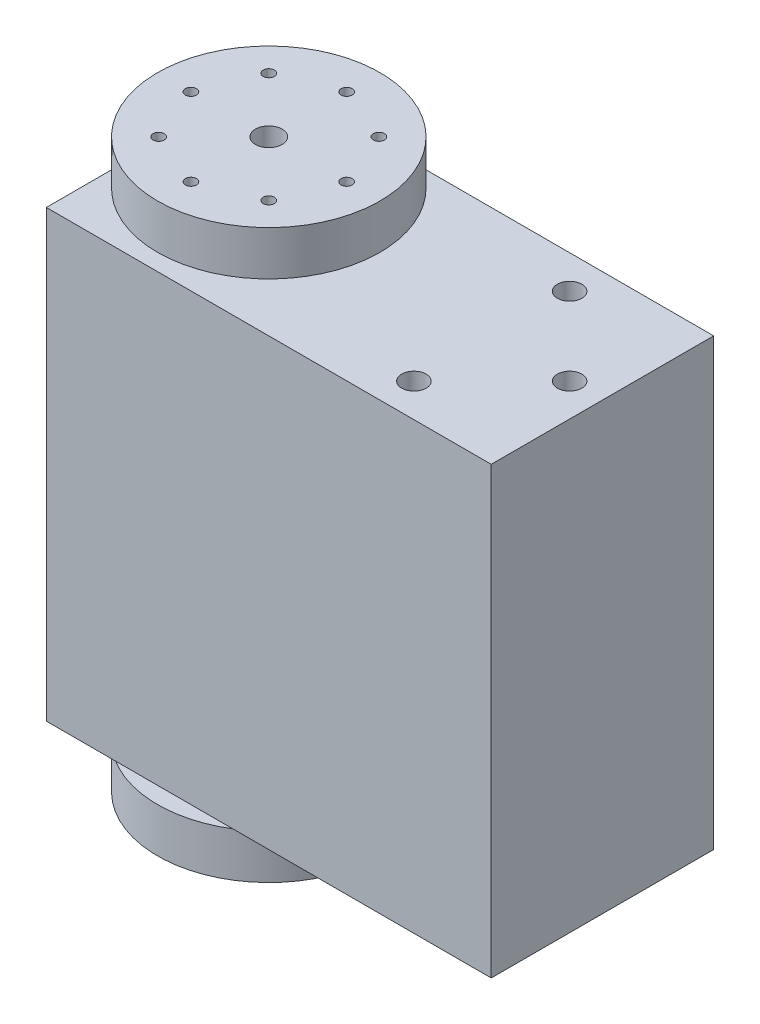
from build123d import *

# Parameters (mm, degrees)
SKETCH1_W           = 40
SKETCH1_H           = 20
BOSS_EXTRUDE1_DEPTH = 40
SKETCH3_R           = 6.5
BOSS_EXTRUDE2_DEPTH = 1.5
BOSS_EXTRUDE3_START = 1.5
SKETCH4_R           = 6.5
BOSS_EXTRUDE3_DEPTH = 1.5
SKETCH5_R           = 10
SKETCH5_R_2         = 1.15
BOSS_EXTRUDE4_DEPTH = 4
BOSS_EXTRUDE6_START = 4
SKETCH6_R           = 10
SKETCH6_R_2         = 1.2
BOSS_EXTRUDE6_DEPTH = 4
SKETCH8_W           = 8
SKETCH8_H           = 5
CUT_EXTRUDE1_DEPTH  = 3
SKETCH9_R           = 1.1
CUT_EXTRUDE2_DEPTH  = 3
SKETCH10_R          = 1.1
CUT_EXTRUDE3_DEPTH  = 3
SKETCH13_R          = 0.5
CUT_EXTRUDE5_DEPTH  = 4
CUT_EXTRUDE6_START  = -4
SKETCH14_R          = 0.5
CUT_EXTRUDE6_DEPTH  = 4


with BuildPart() as part:
    # Sketch1 → Boss-Extrude1 (new body)
    with BuildSketch(Plane(origin=(0, 0, 0), x_dir=(1, 0, 0), z_dir=(0, 1, 0))):
        with Locations((-233.769788889, 149.901843582)):
            Rectangle(SKETCH1_W, SKETCH1_H)
    extrude(amount=BOSS_EXTRUDE1_DEPTH)

    # Sketch3 → Boss-Extrude2 (add)
    with BuildSketch(Plane(origin=(0, 40, 0), x_dir=(1, 0, 0), z_dir=(0, 1, 0))):
        with Locations(Location((-243.769788889, 149.901843582, 0), (0, 0, 270))):
            Circle(SKETCH3_R)
    extrude(amount=BOSS_EXTRUDE2_DEPTH)

    # Sketch4 → Boss-Extrude3 (add)
    with BuildSketch(Plane.XZ.offset(BOSS_EXTRUDE3_START)):
        with Locations(Location((-243.769788889, -149.901843582, 0), (0, 0, 90))):
            Circle(SKETCH4_R)
    extrude(amount=-BOSS_EXTRUDE3_DEPTH)

    # Sketch5 → Boss-Extrude4 (add)
    with BuildSketch(Plane.XZ.offset(1.5)):
        with Locations(Location((-243.769788889, -149.901843582, 0), (0, 0, 270))):
            Circle(SKETCH5_R)
        with Locations(Location((-243.769788889, -149.901843582, 0), (0, 0, 270))):
            Circle(SKETCH5_R_2, mode=Mode.SUBTRACT)
    extrude(amount=BOSS_EXTRUDE4_DEPTH)

    # Sketch6 → Boss-Extrude6 (add)
    with BuildSketch(Plane(origin=(0, 41.5, 0), x_dir=(1, 0, 0), z_dir=(0, 1, 0)).offset(BOSS_EXTRUDE6_START)):
        with Locations(Location((-243.769788889, 149.901843582, 0), (0, 0, 90))):
            Circle(SKETCH6_R)
        with Locations(Location((-243.769788889, 149.901843582, 0), (0, 0, 270))):
            Circle(SKETCH6_R_2, mode=Mode.SUBTRACT)
    extrude(amount=-BOSS_EXTRUDE6_DEPTH)

    # Sketch8 → Cut-Extrude1 (cut)
    with BuildSketch(Plane.ZY.offset(253.769788889)):
        with Locations((-149.901843582, 10.471280392)):
            Rectangle(SKETCH8_W, SKETCH8_H)
    extrude(amount=-CUT_EXTRUDE1_DEPTH, mode=Mode.SUBTRACT)

    # Sketch9 → Cut-Extrude2 (cut)
    with BuildSketch(Plane(origin=(0, 40, 0), x_dir=(1, 0, 0), z_dir=(0, 1, 0))):
        with Locations(Location((-216.719788889, 149.901843582, 0), (0, 0, 270))):
            Circle(SKETCH9_R)
        with Locations(Location((-223.719788889, 142.901843582, 0), (0, 0, 270))):
            Circle(SKETCH9_R)
        with Locations(Location((-223.719788889, 156.901843582, 0), (0, 0, 270))):
            Circle(SKETCH9_R)
    extrude(amount=-CUT_EXTRUDE2_DEPTH, mode=Mode.SUBTRACT)

    # Sketch10 → Cut-Extrude3 (cut)
    with BuildSketch(Plane.XZ):
        with Locations(Location((-216.239788889, -157.401843582, 0), (0, 0, 270))):
            Circle(SKETCH10_R)
        with Locations(Location((-216.239788889, -142.401843582, 0), (0, 0, 270))):
            Circle(SKETCH10_R)
        with Locations(Location((-231.239788889, -157.401843582, 0), (0, 0, 270))):
            Circle(SKETCH10_R)
        with Locations(Location((-231.239788889, -142.401843582, 0), (0, 0, 270))):
            Circle(SKETCH10_R)
    extrude(amount=-CUT_EXTRUDE3_DEPTH, mode=Mode.SUBTRACT)

    # Sketch13 → Cut-Extrude5 (cut)
    with BuildSketch(Plane.XZ.offset(5.5)):
        with Locations(Location((-243.769788889, -142.901843582, 0), (0, 0, 270))):
            Circle(SKETCH13_R)
        with Locations(Location((-238.82004142, -144.952096113, 0), (0, 0, 270))):
            Circle(SKETCH13_R)
        with Locations(Location((-236.769788889, -149.901843582, 0), (0, 0, 270))):
            Circle(SKETCH13_R)
        with Locations(Location((-238.82004142, -154.85159105, 0), (0, 0, 270))):
            Circle(SKETCH13_R)
        with Locations(Location((-243.769788889, -156.901843582, 0), (0, 0, 270))):
            Circle(SKETCH13_R)
        with Locations(Location((-248.719536357, -154.85159105, 0), (0, 0, 270))):
            Circle(SKETCH13_R)
        with Locations(Location((-250.769788889, -149.901843582, 0), (0, 0, 270))):
            Circle(SKETCH13_R)
        with Locations(Location((-248.719536357, -144.952096113, 0), (0, 0, 270))):
            Circle(SKETCH13_R)
    extrude(amount=-CUT_EXTRUDE5_DEPTH, mode=Mode.SUBTRACT)

    # Sketch14 → Cut-Extrude6 (cut)
    with BuildSketch(Plane(origin=(0, 45.5, 0), x_dir=(1, 0, 0), z_dir=(0, 1, 0)).offset(CUT_EXTRUDE6_START)):
        with Locations(Location((-243.769788889, 156.901843582, 0), (0, 0, 90))):
            Circle(SKETCH14_R)
        with Locations(Location((-238.82004142, 154.85159105, 0), (0, 0, 90))):
            Circle(SKETCH14_R)
        with Locations(Location((-236.769788889, 149.901843582, 0), (0, 0, 90))):
            Circle(SKETCH14_R)
        with Locations(Location((-238.82004142, 144.952096113, 0), (0, 0, 90))):
            Circle(SKETCH14_R)
        with Locations(Location((-243.769788889, 142.901843582, 0), (0, 0, 90))):
            Circle(SKETCH14_R)
        with Locations(Location((-248.719536357, 144.952096113, 0), (0, 0, 90))):
            Circle(SKETCH14_R)
        with Locations(Location((-250.769788889, 149.901843582, 0), (0, 0, 90))):
            Circle(SKETCH14_R)
        with Locations(Location((-248.719536357, 154.85159105, 0), (0, 0, 90))):
            Circle(SKETCH14_R)
    extrude(amount=CUT_EXTRUDE6_DEPTH, mode=Mode.SUBTRACT)


solid = part.part
